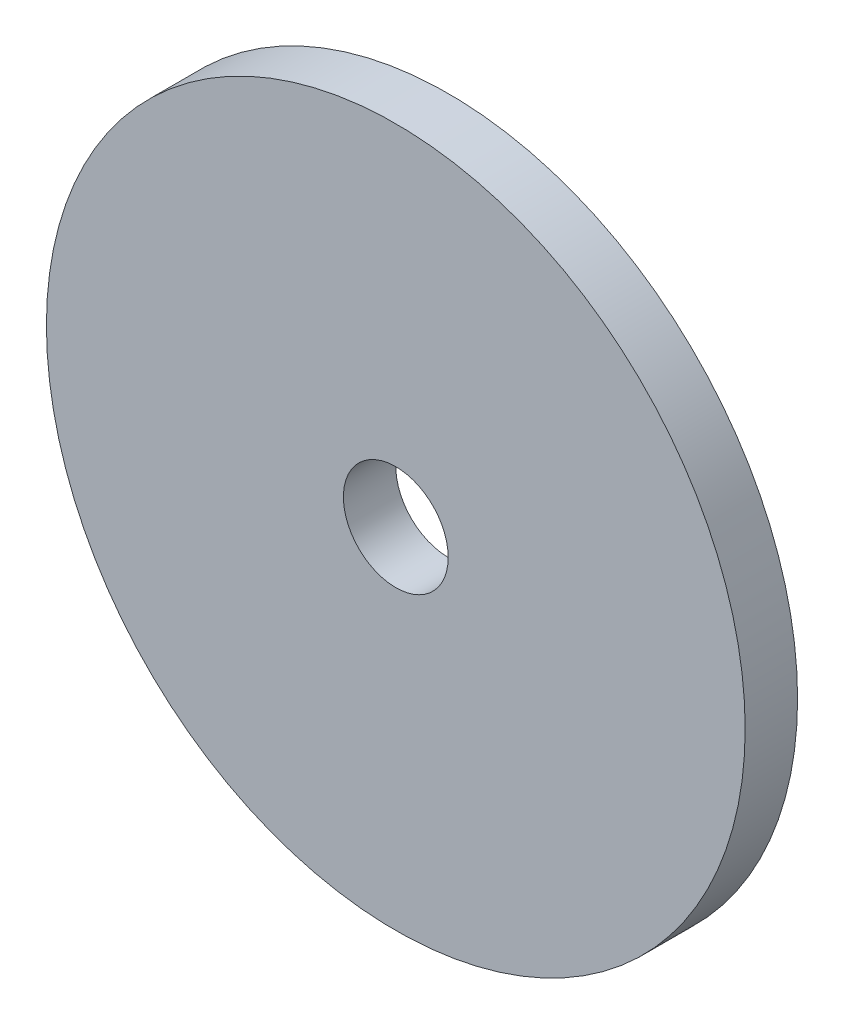
from build123d import *

# Parameters (mm, degrees)
SKETCH_1_R      = 40
SKETCH_1_R_2    = 6
EXTRUDE_1_DEPTH = 6


with BuildPart() as part:
    # 草图1 → 凸台-拉伸1 (new body)
    with BuildSketch(Plane.XY):
        Circle(SKETCH_1_R)
        Circle(SKETCH_1_R_2, mode=Mode.SUBTRACT)
    extrude(amount=EXTRUDE_1_DEPTH)


solid = part.part
